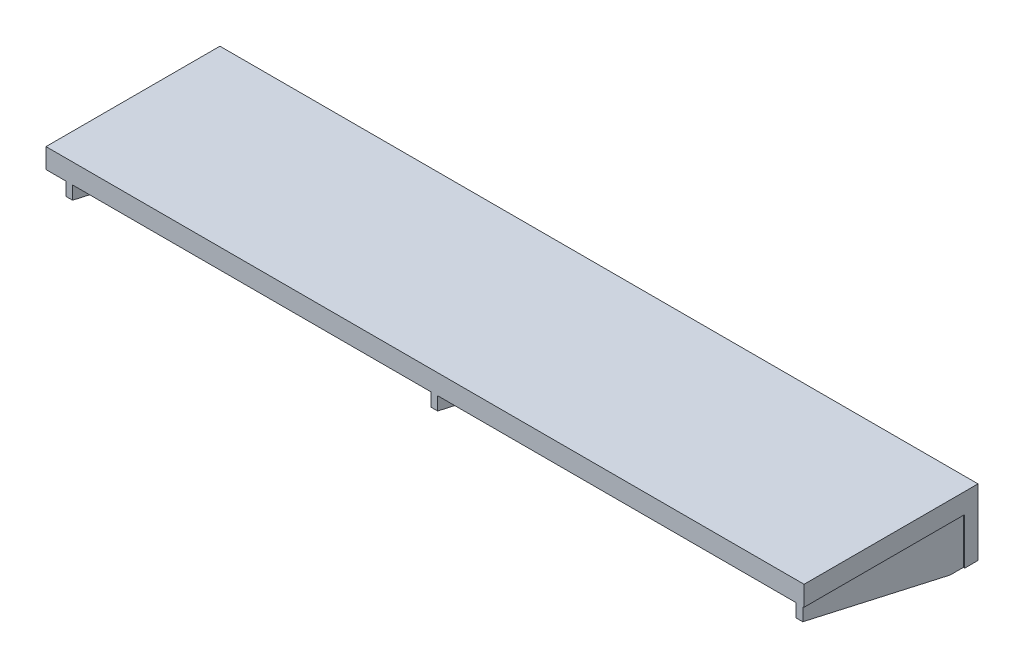
from build123d import *

# Parameters (mm, degrees)
SKETCH_1_W             = 1142
SKETCH_1_H             = 100
EXTRUDE_1_DEPTH        = 20
SKETCH_2_W             = 1142
SKETCH_2_H             = 30
EXTRUDE_2_DEPTH        = 242
EXTRUDE_START          = -30
EXTRUDE_3_DEPTH        = 10
PATTERN_LINEAR_1_COUNT = 3
PATTERN_LINEAR_1_PITCH = 550


with BuildPart() as part:
    # 草图1 → 凸台-拉伸1 (new body)
    with BuildSketch(Plane.XY):
        Rectangle(SKETCH_1_W, SKETCH_1_H)
    extrude(amount=EXTRUDE_1_DEPTH)



with BuildPart() as body_2:
    # 草图2 → 凸台-拉伸2 (new body)
    with BuildSketch(Plane.XY.offset(20)):
        with Locations((0, 35)):
            Rectangle(SKETCH_2_W, SKETCH_2_H)
    extrude(amount=EXTRUDE_2_DEPTH)


with BuildPart() as part_1:
    add(part.part)

    add(body_2.part)  # 凸台-拉伸3 merges body 2
    # 草图3 → 凸台-拉伸3 (add)
    with BuildSketch(Plane.ZY.offset(571).offset(EXTRUDE_START)):
        Polygon((262, 20), (20, 20), (20, -50), (40, -50), (262, 0), align=None)
    extrude_3 = extrude(amount=-EXTRUDE_3_DEPTH)

    # 阵列(线性)1: 凸台-拉伸3 ×3
    with Locations(*[(i * PATTERN_LINEAR_1_PITCH, 0, 0) for i in range(1, PATTERN_LINEAR_1_COUNT)]):
        add(extrude_3)


solid = part_1.part
